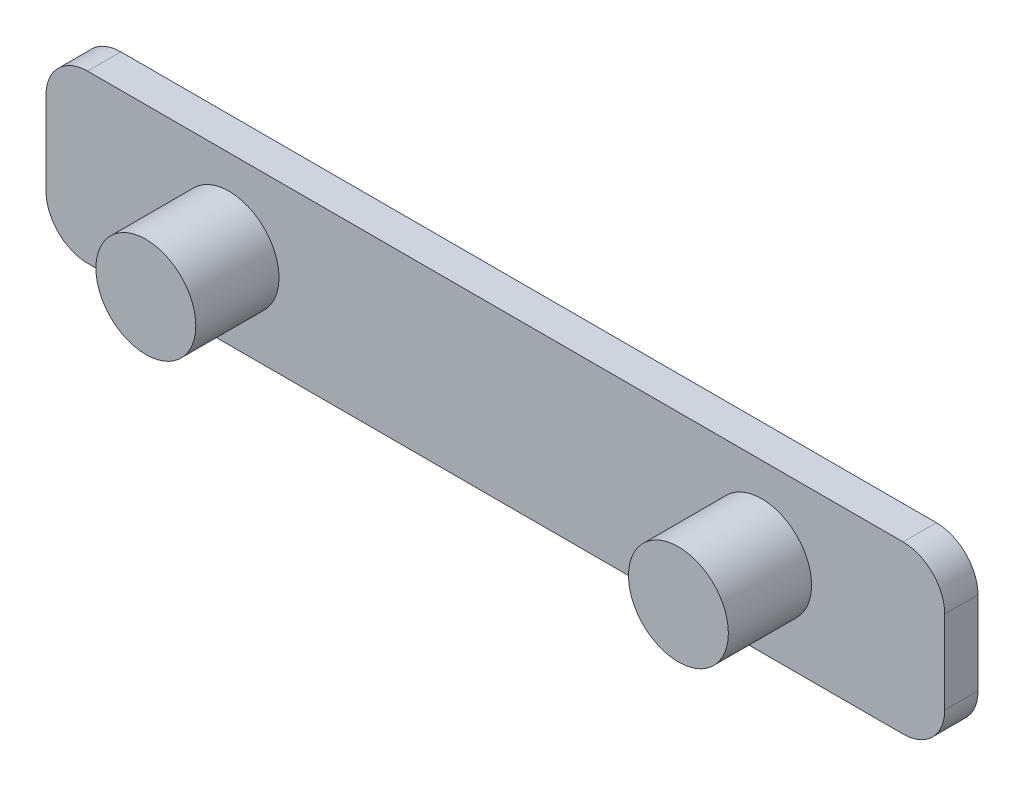
from build123d import *

# Parameters (mm, degrees)
BOSS_EXTRUDE1_DEPTH = 2
SKETCH2_R           = 3
BOSS_EXTRUDE2_DEPTH = 5


with BuildPart() as part:
    # Sketch1 → Boss-Extrude1 (new body)
    with BuildSketch(Plane.XY):
        with BuildLine():
            Line((-5.313337951, 3.839414132), (43.686662049, 3.839414132))
            ThreePointArc((43.686662049, 3.839414132), (45.454429002, 3.107181085), (46.186662049, 1.339414132))
            Line((46.186662049, 1.339414132), (46.186662049, -3.660585868))
            ThreePointArc((46.186662049, -3.660585868), (45.454429002, -5.428352821), (43.686662049, -6.160585868))
            Line((43.686662049, -6.160585868), (-5.313337951, -6.160585868))
            ThreePointArc((-5.313337951, -6.160585868), (-7.081104904, -5.428352821), (-7.813337951, -3.660585868))
            Line((-7.813337951, -3.660585868), (-7.813337951, 1.339414132))
            ThreePointArc((-7.813337951, 1.339414132), (-7.081104904, 3.107181085), (-5.313337951, 3.839414132))
        make_face()
    extrude(amount=BOSS_EXTRUDE1_DEPTH)

    # Sketch2 → Boss-Extrude2 (add)
    with BuildSketch(Plane.XY.offset(2)):
        with Locations(Location((3.186662049, -1.160585868, 0), (0, 0, 180))):
            Circle(SKETCH2_R)
        with Locations(Location((35.186662049, -1.160585868, 0), (0, 0, 180))):
            Circle(SKETCH2_R)
    extrude(amount=BOSS_EXTRUDE2_DEPTH)


solid = part.part
